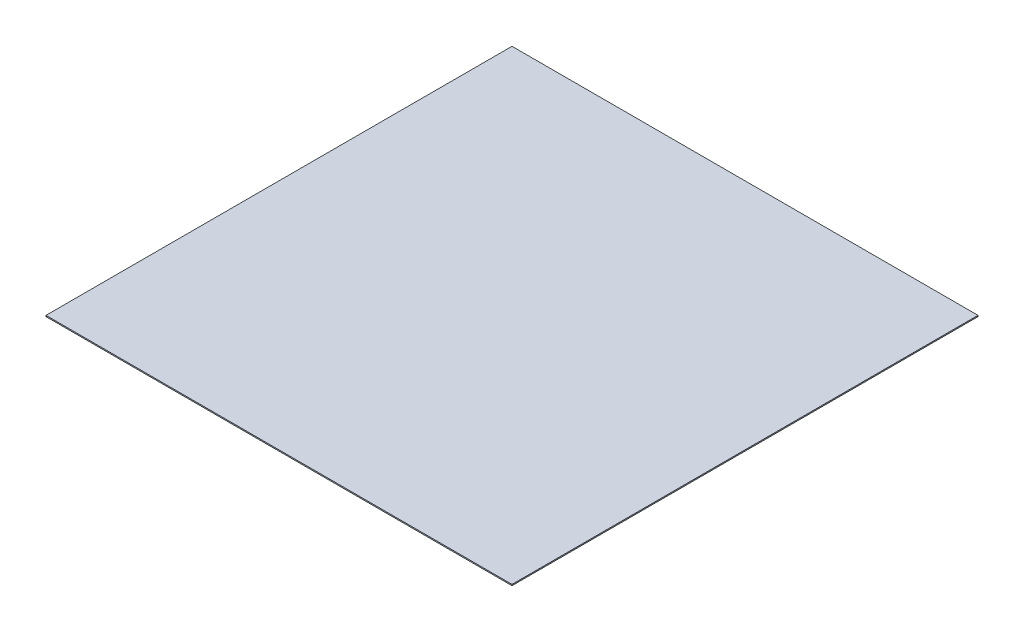
from build123d import *

# Parameters (mm, degrees)
SKETCH_1_W      = 400
SKETCH_1_H      = 400
EXTRUDE_1_DEPTH = 1


with BuildPart() as part:
    # 草图1 → 凸台-拉伸1 (new body)
    with BuildSketch(Plane(origin=(0, 0, 0), x_dir=(1, 0, 0), z_dir=(0, 1, 0))):
        Rectangle(SKETCH_1_W, SKETCH_1_H)
    extrude(amount=EXTRUDE_1_DEPTH)


solid = part.part
